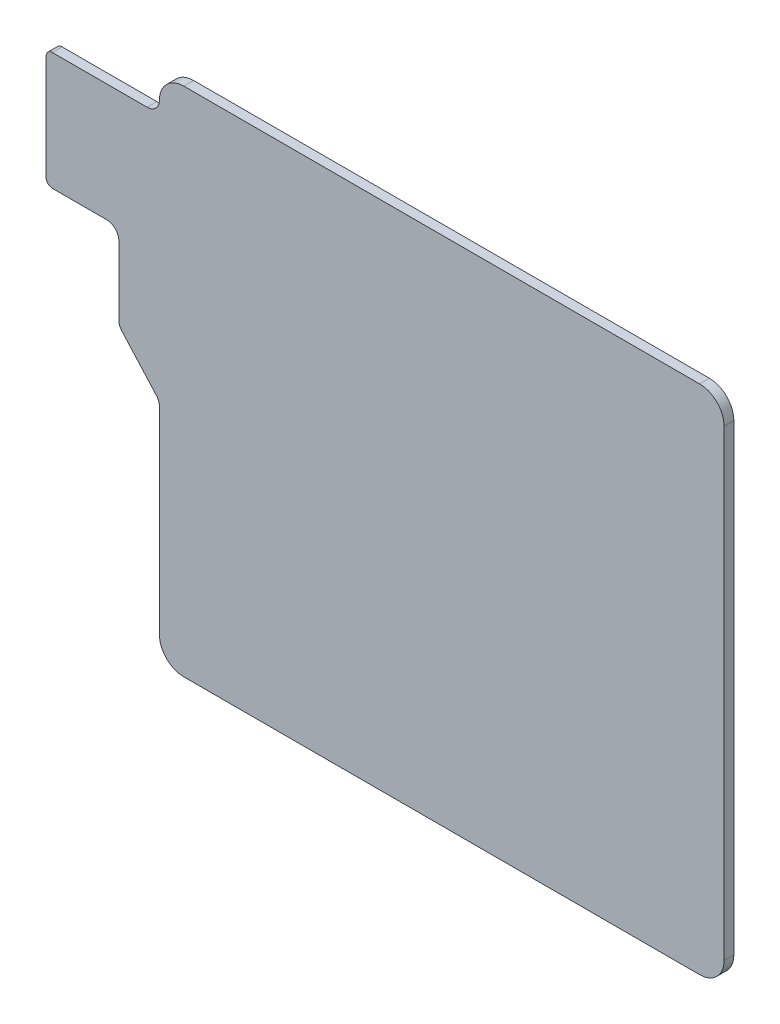
from build123d import *

# Parameters (mm, degrees)
BOSS_EXTRUDE6_DEPTH = 1.6


with BuildPart() as part:
    # Sketch1 → Boss-Extrude6 (new body)
    with BuildSketch(Plane.XY):
        with BuildLine():
            Line((21.906891383, -3.406135598), (106.362891383, -3.406135598))
            ThreePointArc((106.362891383, -3.406135598), (109.191318508, -2.234562723), (110.362891383, 0.593864402))
            Line((110.362891383, 0.593864402), (110.362891383, 76.363864402))
            ThreePointArc((110.362891383, 76.363864402), (109.191318508, 79.192291526), (106.362891383, 80.363864402))
            Line((106.362891383, 80.363864402), (21.906791383, 80.363864402))
            ThreePointArc((21.906791383, 80.363864402), (19.078364258, 79.192291526), (17.906791383, 76.363864402))
            ThreePointArc((17.906791383, 76.363864402), (17.321004945, 74.949650839), (15.906791383, 74.363864402))
            Line((15.906791383, 74.363864402), (0.364791383, 74.363864402))
            ThreePointArc((0.364791383, 74.363864402), (-0.342315398, 74.070971183), (-0.635208617, 73.363864402))
            Line((-0.635208617, 73.363864402), (-0.63368713, 56.102469993))
            ThreePointArc((-0.63368713, 56.102469993), (-0.340793912, 55.395363212), (0.36631287, 55.102469993))
            Line((0.36631287, 55.102469993), (9.26811287, 55.102469993))
            ThreePointArc((9.26811287, 55.102469993), (10.682326432, 54.516683555), (11.26811287, 53.102469993))
            Line((11.26811287, 53.102469993), (11.26811287, 41.868269993))
            ThreePointArc((11.26811287, 41.868269993), (11.400327258, 41.153163772), (11.779489777, 40.532604882))
            Line((11.779489777, 40.532604882), (17.330914678, 34.345440723))
            ThreePointArc((17.330914678, 34.345440723), (17.757303341, 33.700014666), (17.906891383, 32.941064402))
            Line((17.906891383, 32.941064402), (17.906891383, 0.593864402))
            ThreePointArc((17.906891383, 0.593864402), (19.078464258, -2.234562723), (21.906891383, -3.406135598))
        make_face()
    extrude(amount=BOSS_EXTRUDE6_DEPTH)


solid = part.part
